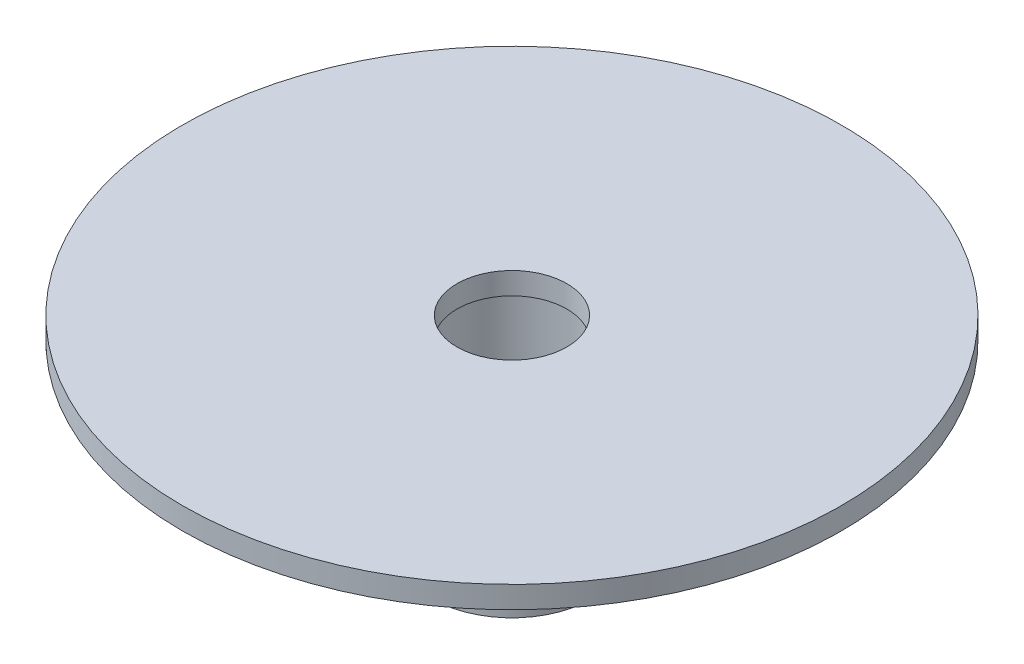
from build123d import *

# Parameters (mm, degrees)
SKETCH1_R           = 45
SKETCH1_R_2         = 7.5
BOSS_EXTRUDE1_DEPTH = 3
SKETCH2_R           = 11
SKETCH2_R_2         = 9
BOSS_EXTRUDE2_DEPTH = 25


with BuildPart() as part:
    # Sketch1 → Boss-Extrude1 (new body)
    with BuildSketch(Plane(origin=(0, 0, 0), x_dir=(1, 0, 0), z_dir=(0, 1, 0))):
        with Locations(Location((0, 0, 0), (0, 0, 270))):
            Circle(SKETCH1_R)
        with Locations(Location((0, 0, 0), (0, 0, 270))):
            Circle(SKETCH1_R_2, mode=Mode.SUBTRACT)
    extrude(amount=BOSS_EXTRUDE1_DEPTH)

    # Sketch2 → Boss-Extrude2 (add)
    with BuildSketch(Plane.XZ):
        with Locations(Location((0, 0, 0), (0, 0, 90))):
            Circle(SKETCH2_R)
        with Locations(Location((0, 0, 0), (0, 0, 270))):
            Circle(SKETCH2_R_2, mode=Mode.SUBTRACT)
    extrude(amount=BOSS_EXTRUDE2_DEPTH)


solid = part.part
